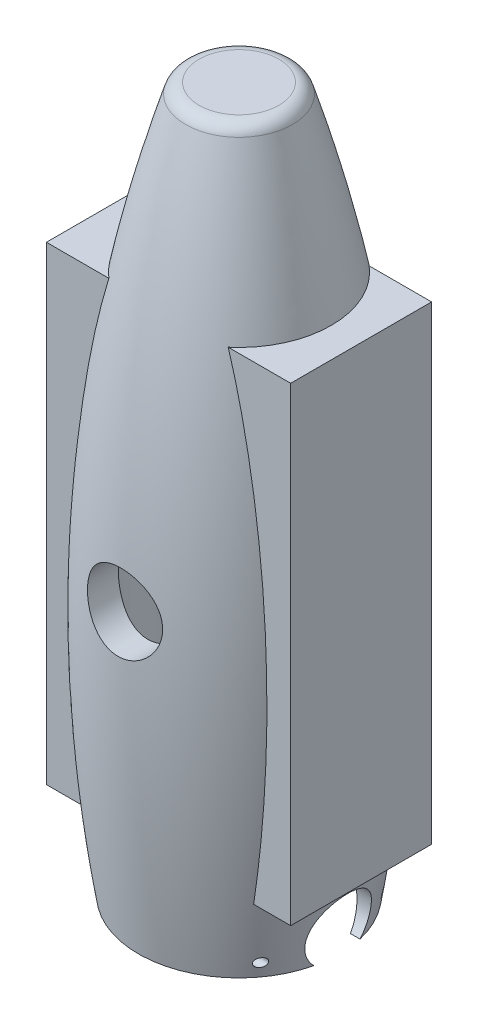
from build123d import *

# Parameters (mm, degrees)
FILLET_ON_TOP_EDGE_R                 = 3
SKETCH7_R                            = 7
CUT_FOR_WIRES_DEPTH                  = 150.507360339
SKETCH8_R                            = 19.424285286
CUT_FOR_HOLLOW_INSIDE_DEPTH          = 105
SKETCH9_R                            = 8
CUT_FOR_SIDE_BUTTON_DEPTH            = 150.507360339
RIGHT_PCB_PLATE_REACH                = 158.103
SKETCH10_W                           = 30
SKETCH10_H                           = 100
CUTS_FOR_BODY_SCREW_HOLES_DEPTH      = 150.548404931
CUTS_FOR_BODY_SCREW_HOLES_DEPTH_BACK = 150.548404931
SKETCH11_R                           = 1


with BuildPart() as part:
    # Sketch2 → Main Body (revolve)
    with BuildSketch(Plane.XY):
        with BuildLine():
            Line((0, 145), (0, -5))
            Line((0, -5), (21.424285286, -5))
            add(Edge.make_bspline(
                [(10.712142643, 145), (33.843636783, 71.251754866), (21.424285286, -5)],
                knots=[0, 0, 0, 1, 1, 1], degree=2))
            Line((10.712142643, 145), (0, 145))
        make_face()
    revolve(axis=Axis((0, 145, 0), (0, -1, 0)))

    # Fillet on Top Edge
    fillet_on_top_edge_edges = [part.edges().sort_by_distance(p)[0] for p in [
        (-10.712142643, 145, 0),
    ]]
    fillet(fillet_on_top_edge_edges, radius=FILLET_ON_TOP_EDGE_R)

    # Sketch7 → Cut for Wires (cut, through all)
    with BuildSketch(Plane(origin=(0, 0, 0), x_dir=(0, 0, -1), z_dir=(1, 0, 0))):
        Circle(SKETCH7_R)
    extrude(amount=CUT_FOR_WIRES_DEPTH, mode=Mode.SUBTRACT)

    # Sketch8 → Cut for Hollow Inside (cut)
    with BuildSketch(Plane.XZ.offset(5)):
        Circle(SKETCH8_R)
    extrude(amount=-CUT_FOR_HOLLOW_INSIDE_DEPTH, mode=Mode.SUBTRACT)

    # Sketch9 → Cut for Side Button (cut, through all)
    with BuildSketch(Plane.XY):
        with Locations((0, 60)):
            Circle(SKETCH9_R)
    extrude(amount=CUT_FOR_SIDE_BUTTON_DEPTH, mode=Mode.SUBTRACT)

    # Sketch10 → Right PCB Plate (add, up to next)
    with BuildSketch(Plane(origin=(-26, 0, 0), x_dir=(0, 0, -1), z_dir=(1, 0, 0)), mode=Mode.PRIVATE) as right_pcb_plate_sk1:
        with Locations((0, 60)):
            Rectangle(SKETCH10_W, SKETCH10_H)
    right_pcb_plate_tool1 = extrude(right_pcb_plate_sk1.sketch, amount=RIGHT_PCB_PLATE_REACH, mode=Mode.PRIVATE) - part.part
    right_pcb_plate = right_pcb_plate_tool1.solids().sort_by_distance((-26, 60, 0))[0]
    add(right_pcb_plate)

    # Left PCB Plate: Right PCB Plate across plane
    add(right_pcb_plate.mirror(Plane(origin=(0, 0, 0), x_dir=(0, 0, 1), z_dir=(1, 0, 0))))

    # Sketch11 → Cuts for Body Screw Holes (cut, two sides: drawn at the far end of the back side and taken through both)
    with BuildSketch(Plane(origin=(0, 0, 0), x_dir=(0, 0, -1), z_dir=(1, 0, 0)).offset(-CUTS_FOR_BODY_SCREW_HOLES_DEPTH_BACK)):
        with Locations((-13, -2)):
            Circle(SKETCH11_R)
        with Locations((13, -2)):
            Circle(SKETCH11_R)
    extrude(amount=CUTS_FOR_BODY_SCREW_HOLES_DEPTH + CUTS_FOR_BODY_SCREW_HOLES_DEPTH_BACK, mode=Mode.SUBTRACT)


solid = part.part
